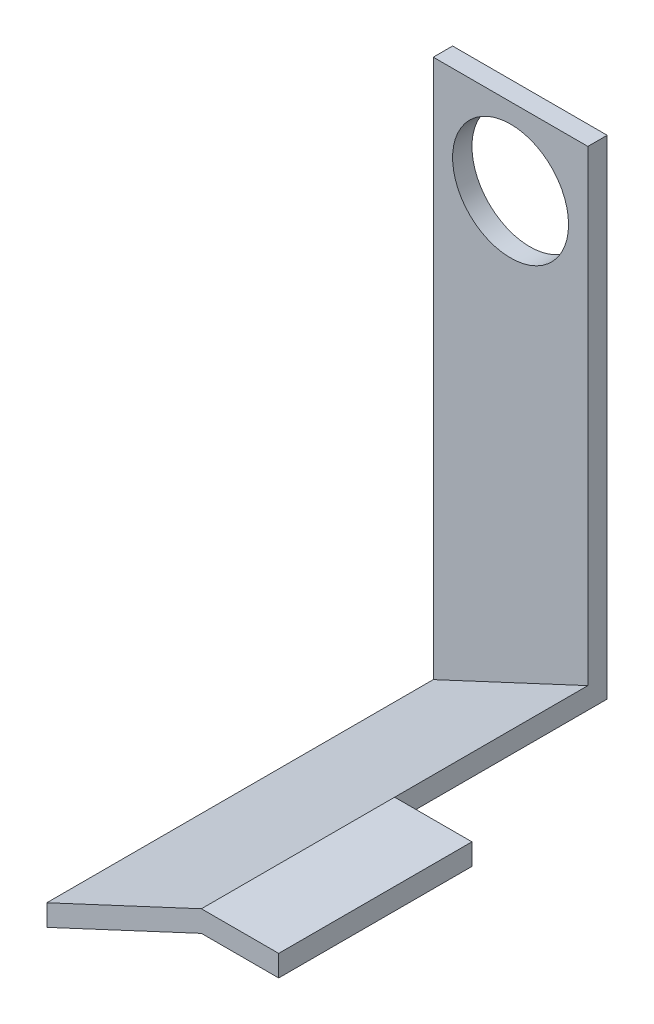
from build123d import *

# Parameters (mm, degrees)
SKETCH_4_R      = 1.5
EXTRUDE_3_DEPTH = 0.5
EXTRUDE_4_DEPTH = 10
SKETCH_6_W      = 5
SKETCH_6_H      = 0.551688959
EXTRUDE_5_DEPTH = 2


with BuildPart() as part:
    # Эскиз4 → Бобышка-Вытянуть3 (new body)
    with BuildSketch(Plane.XY):
        Polygon((-2, -8.5), (2, -6.634769367), (2, 6), (-2, 6), align=None)
        with Locations((0, 4)):
            Circle(SKETCH_4_R, mode=Mode.SUBTRACT)
    extrude(amount=EXTRUDE_3_DEPTH)

    # Эскиз5 → Бобышка-Вытянуть4 (add)
    with BuildSketch(Plane.XY.offset(0.5)):
        Polygon((-2, -8.5), (2, -6.634769367), (2, -6.083080408), (-2, -7.948311041), align=None)
    extrude(amount=EXTRUDE_4_DEPTH)

    # Эскиз6 → Бобышка-Вытянуть5 (add)
    with BuildSketch(Plane(origin=(2, 0, 0), x_dir=(0, 0, -1), z_dir=(1, 0, 0))):
        with Locations((-8, -6.358924888)):
            Rectangle(SKETCH_6_W, SKETCH_6_H)
    extrude(amount=EXTRUDE_5_DEPTH)


solid = part.part
